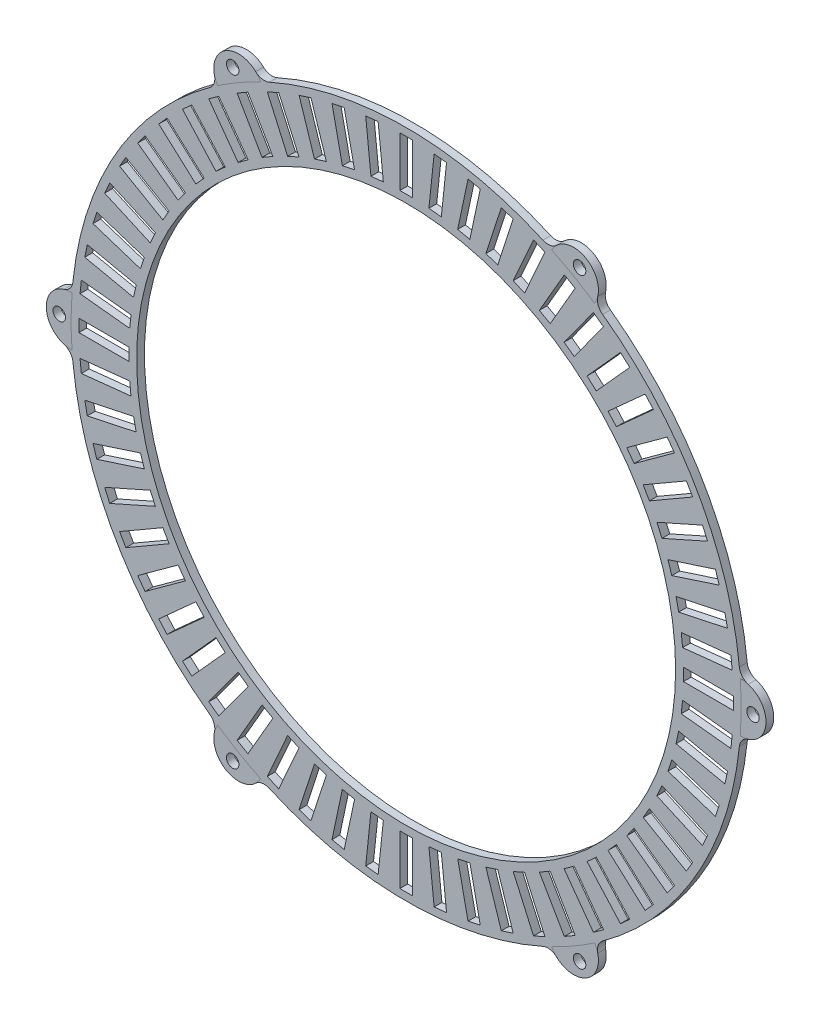
from build123d import *

# Parameters (mm, degrees)
SKETCH1_R                 = 68.183125
SKETCH1_R_2               = 54.848125
BOSS_EXTRUDE1_DEPTH       = 1.5875
SKETCH4_W                 = 2.54
SKETCH4_H                 = 10.16
CUT_EXTRUDE3_DEPTH        = 5.08
CIRPATTERN2_COUNT         = 60
BOSS_EXTRUDE2_START       = -1.5875
BOSS_EXTRUDE2_DEPTH       = 1.587512
FILLET1_R                 = 2.54
SKETCH9_R                 = 1.27
CUT_EXTRUDE6_DEPTH        = 101.073304112
CIRPATTERN12_COUNT        = 6
FILLET1_OF_CIRPATTERN12_R = 2.54


with BuildPart() as part:
    # Sketch1 → Boss-Extrude1 (new body)
    with BuildSketch(Plane.XY):
        Circle(SKETCH1_R)
        Circle(SKETCH1_R_2, mode=Mode.SUBTRACT)
    extrude(amount=BOSS_EXTRUDE1_DEPTH)

    # Sketch4 → Cut-Extrude3 (cut)
    with BuildSketch(Plane.XY.offset(1.5875)):
        with Locations((0, 61.515625)):
            Rectangle(SKETCH4_W, SKETCH4_H)
    cut_extrude3 = extrude(amount=-CUT_EXTRUDE3_DEPTH, mode=Mode.SUBTRACT)

    # CirPattern2: Cut-Extrude3 ×60 about axis
    cirpattern2_axis = Axis((0, 0, 0), (0, 0, 1))
    for i in range(1, CIRPATTERN2_COUNT):
        add(cut_extrude3.rotate(cirpattern2_axis, i * 360 / CIRPATTERN2_COUNT), mode=Mode.SUBTRACT)

    # Sketch8 → Boss-Extrude2 (add)
    with BuildSketch(Plane.XY.offset(1.5875).offset(BOSS_EXTRUDE2_START)):
        with BuildLine():
            ThreePointArc((67.996051163, 5.047332074), (73.233922728, 0), (67.996051163, -5.047332074))
            ThreePointArc((67.996051163, -5.047332074), (68.183125, 0), (67.996051163, 5.047332074))
        make_face()
    boss_extrude2 = extrude(amount=BOSS_EXTRUDE2_DEPTH)

    # Fillet1
    fillet1_edges = [part.edges().sort_by_distance(p)[0] for p in [
        (67.996051163, -5.047332074, 0.79375),
        (67.996051163, 5.047332074, 0.79375),
    ]]
    fillet(fillet1_edges, radius=FILLET1_R)

    # Sketch9 → Cut-Extrude6 (cut, symmetric)
    with BuildSketch(Plane.XY.offset(1.587512)):
        with Locations((70.596125, 0)):
            Circle(SKETCH9_R)
    cut_extrude6 = extrude(amount=CUT_EXTRUDE6_DEPTH, both=True, mode=Mode.SUBTRACT)

    # CirPattern12: Boss-Extrude2, Cut-Extrude6 ×6 about axis
    cirpattern12_axis = Axis((0, 0, 0), (0, 0, 1))
    add([boss_extrude2.rotate(cirpattern12_axis, i * 360 / CIRPATTERN12_COUNT) for i in range(1, CIRPATTERN12_COUNT)])
    add([cut_extrude6.rotate(cirpattern12_axis, i * 360 / CIRPATTERN12_COUNT) for i in range(1, CIRPATTERN12_COUNT)], mode=Mode.SUBTRACT)

    # Fillet1 of CirPattern12
    fillet1_of_cirpattern12_edges = [part.edges().sort_by_distance(p)[0] for p in [
        (38.369143379, 56.362641627, 0.79375),
        (29.626907783, 61.409973701, 0.79375),
        (-29.626907783, 61.409973701, 0.79375),
        (-38.369143379, 56.362641627, 0.79375),
        (-67.996051163, 5.047332074, 0.79375),
        (-67.996051163, -5.047332074, 0.79375),
        (-38.369143379, -56.362641627, 0.79375),
        (-29.626907783, -61.409973701, 0.79375),
        (29.626907783, -61.409973701, 0.79375),
        (38.369143379, -56.362641627, 0.79375),
    ]]
    fillet(fillet1_of_cirpattern12_edges, radius=FILLET1_OF_CIRPATTERN12_R)


solid = part.part
